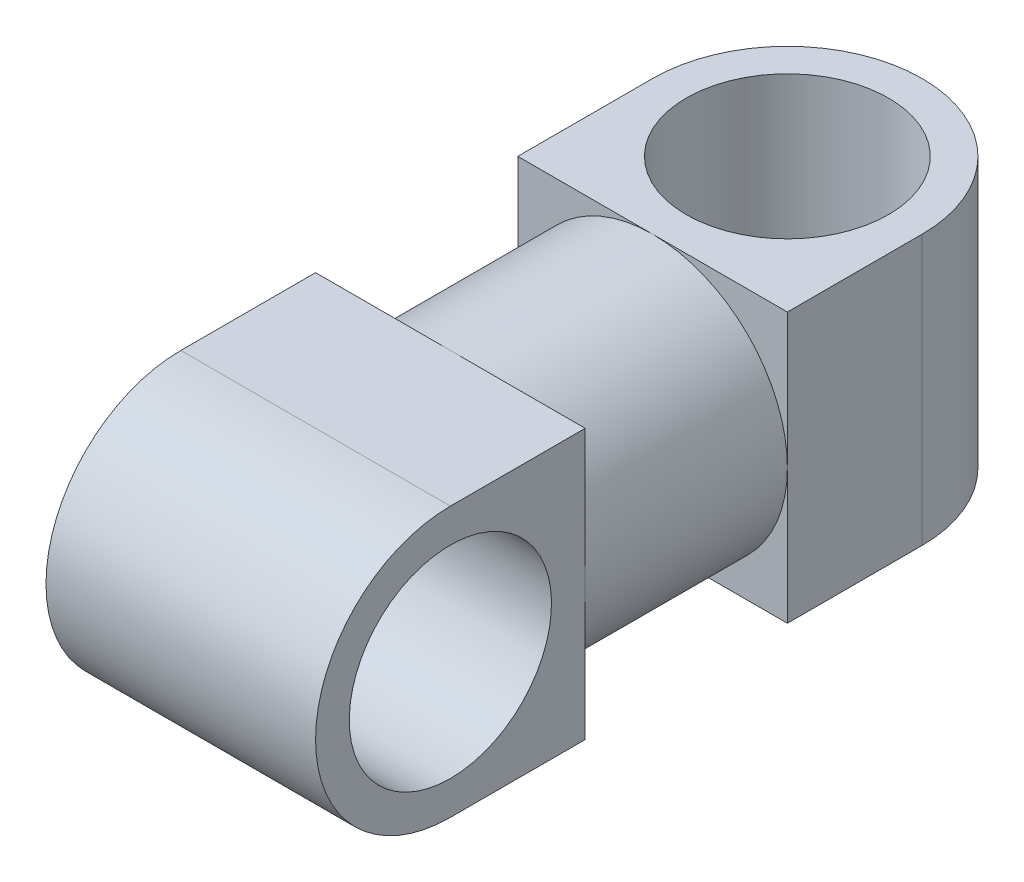
from build123d import *

# Parameters (mm, degrees)
SKETCH1_R           = 15
BOSS_EXTRUDE1_DEPTH = 40
BOSS_EXTRUDE2_START = 20
SKETCH2_R           = 20
BOSS_EXTRUDE2_DEPTH = 30
SKETCH3_R           = 15
BOSS_EXTRUDE3_DEPTH = 40


with BuildPart() as part:
    # Sketch1 → Boss-Extrude1 (new body)
    with BuildSketch(Plane(origin=(0, 0, 0), x_dir=(1, 0, 0), z_dir=(0, 1, 0))):
        with BuildLine():
            Line((-20, -20), (20, -20))
            Line((20, -20), (20, 0))
            ThreePointArc((20, 0), (0, 20), (-20, 0))
            Line((-20, 0), (-20, -20))
        make_face()
        with Locations(Location((0, 0, 0), (0, 0, 270))):
            Circle(SKETCH1_R, mode=Mode.SUBTRACT)
    extrude(amount=BOSS_EXTRUDE1_DEPTH)

    # Sketch2 → Boss-Extrude2 (add)
    with BuildSketch(Plane.XY.offset(BOSS_EXTRUDE2_START)):
        with Locations((0, 20)):
            Circle(SKETCH2_R)
    extrude(amount=BOSS_EXTRUDE2_DEPTH)

    # Sketch3 → Boss-Extrude3 (add)
    with BuildSketch(Plane.ZY.offset(20)):
        with BuildLine():
            Line((50, 40.055924185), (50, 0.055924185))
            Line((50, 0.055924185), (70, 0.055924185))
            ThreePointArc((70, 0.055924185), (90, 20.055924185), (70, 40.055924185))
            Line((70, 40.055924185), (50, 40.055924185))
        make_face()
        with Locations(Location((70, 20.055924185, 0), (0, 0, 270))):
            Circle(SKETCH3_R, mode=Mode.SUBTRACT)
    extrude(amount=-BOSS_EXTRUDE3_DEPTH)


solid = part.part
